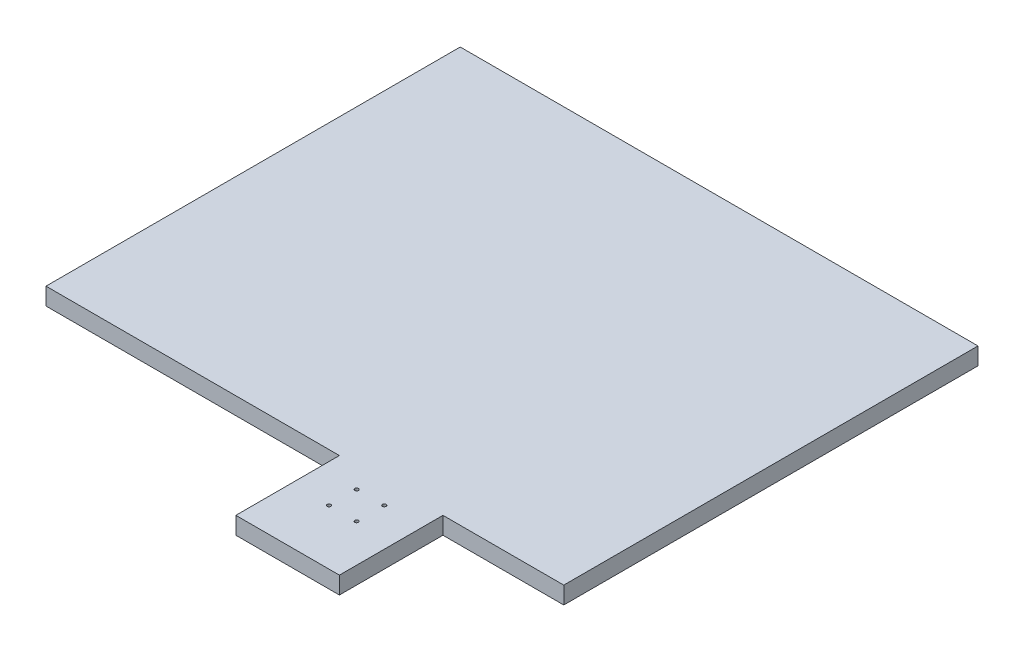
from build123d import *

# Parameters (mm, degrees)
EXTRUDE_1_DEPTH     = 10
SKETCH_2_W          = 20
SKETCH_2_H          = 20
SKETCH_2_R          = 1.05
CUT_EXTRUDE_1_DEPTH = 8
SKETCH_2_3_R        = 1.05
CUT_EXTRUDE_2_DEPTH = 235.520787991


with BuildPart() as part:
    # 草圖1 → 填料-伸長1 (new body)
    with BuildSketch(Plane(origin=(0, 0, 0), x_dir=(1, 0, 0), z_dir=(0, 1, 0))):
        Polygon((-150, -120), (20, -120), (20, -180), (80, -180), (80, -120), (150, -120), (150, 120), (-150, 120), align=None)
    extrude(amount=EXTRUDE_1_DEPTH)

    # 草圖2 → 除料-伸長1 (cut)
    with BuildSketch(Plane.XZ):
        with Locations((50, 140)):
            Rectangle(SKETCH_2_W, SKETCH_2_H)
        with Locations((42, 132)):
            Circle(SKETCH_2_R, mode=Mode.SUBTRACT)
        with Locations((58, 132)):
            Circle(SKETCH_2_R, mode=Mode.SUBTRACT)
        with Locations((42, 148)):
            Circle(SKETCH_2_R, mode=Mode.SUBTRACT)
        with Locations((58, 148)):
            Circle(SKETCH_2_R, mode=Mode.SUBTRACT)
    extrude(amount=-CUT_EXTRUDE_1_DEPTH, mode=Mode.SUBTRACT)

    # 草圖2<3> → 除料-伸長2 (cut, through all)
    with BuildSketch(Plane.XZ):
        with Locations((42, 132)):
            Circle(SKETCH_2_3_R)
        with Locations((42, 148)):
            Circle(SKETCH_2_3_R)
        with Locations((58, 132)):
            Circle(SKETCH_2_3_R)
        with Locations((58, 148)):
            Circle(SKETCH_2_3_R)
    extrude(amount=-CUT_EXTRUDE_2_DEPTH, mode=Mode.SUBTRACT)


solid = part.part
